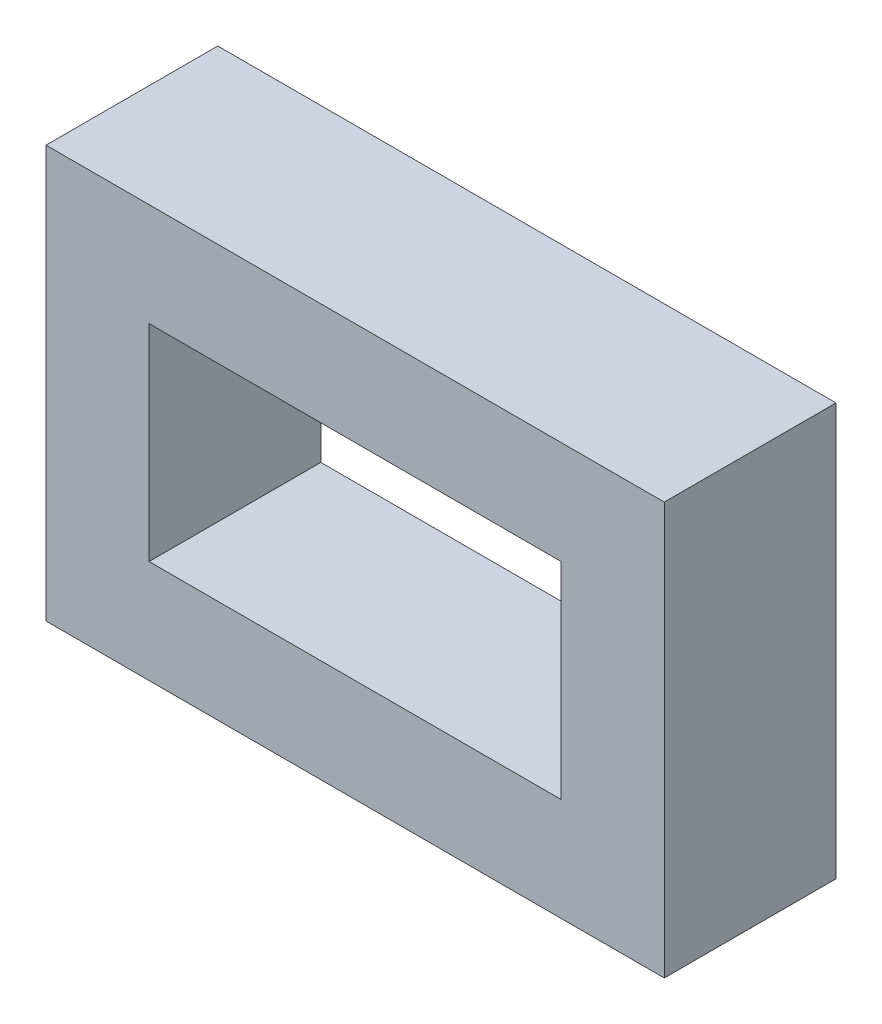
from build123d import *

# Parameters (mm, degrees)
SKETCH1_W     = 18
SKETCH1_H     = 12
SKETCH1_W_2   = 12
SKETCH1_H_2   = 6
PROFILE_DEPTH = 5


with BuildPart() as part:
    # Sketch1 → Profile (new body)
    with BuildSketch(Plane.XY):
        with Locations((9, 6)):
            Rectangle(SKETCH1_W, SKETCH1_H)
        with Locations((9, 6)):
            Rectangle(SKETCH1_W_2, SKETCH1_H_2, mode=Mode.SUBTRACT)
    extrude(amount=PROFILE_DEPTH)


solid = part.part
